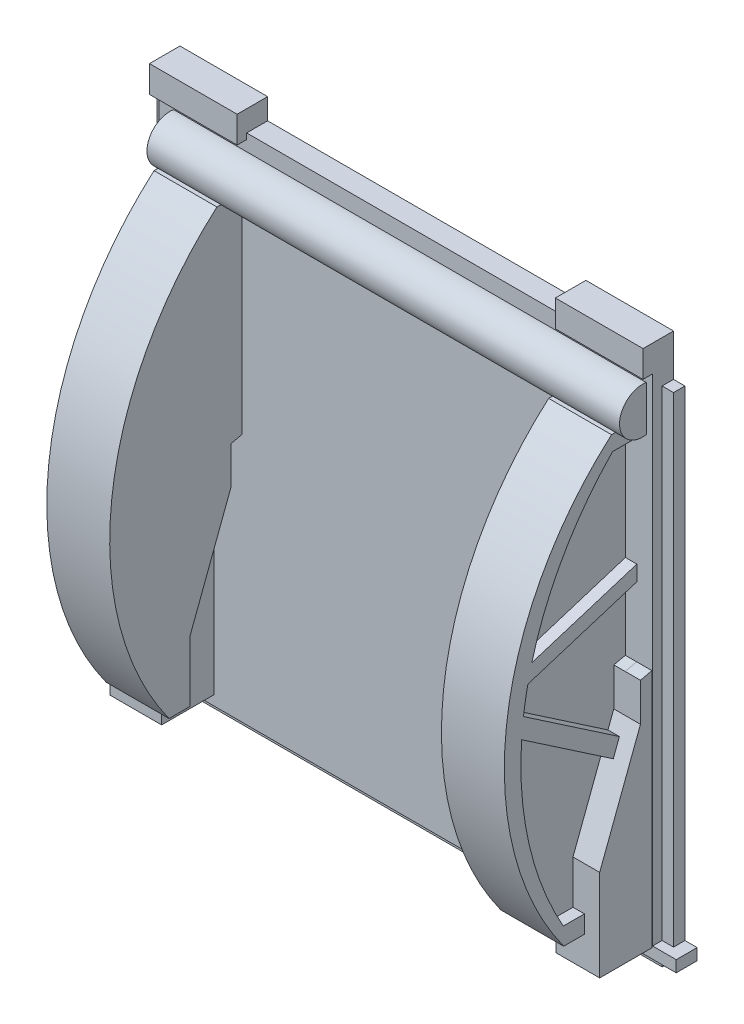
from build123d import *

# Parameters (mm, degrees)
BOSS_EXTRUDE1_DEPTH       = 3
BOSS_EXTRUDE2_DEPTH       = 2.5
SKETCH3_W                 = 23
SKETCH3_H                 = 7
SKETCH3_W_2               = 22.99999237
BOSS_EXTRUDE3_DEPTH       = 2.5
BOSS_EXTRUDE4_DEPTH       = 2.5
BOSS_EXTRUDE4_DEPTH_BACK  = 121.5
BOSS_EXTRUDE5_DEPTH       = 16.5
BOSS_EXTRUDE6_DEPTH       = 4
BOSS_EXTRUDE6_DEPTH_BACK  = 7.5
CUT_EXTRUDE1_DEPTH        = 3
BOSS_EXTRUDE10_DEPTH      = 3
BOSS_EXTRUDE11_DEPTH      = 16.5
CUT_EXTRUDE4_DEPTH        = 3
BOSS_EXTRUDE12_DEPTH      = 3
BOSS_EXTRUDE17_DEPTH      = 9
BOSS_EXTRUDE17_DEPTH_BACK = 4.5


with BuildPart() as part:
    # Sketch1 → Boss-Extrude1 (new body)
    with BuildSketch(Plane.XY):
        Polygon((46.09763001, 79.281773963), (69.09763001, 79.281773963), (69.09763001, 68.281773963), (72.09763001, 68.281773963), (72.09763001, -57.718233666), (75.297626958, -57.718233666), (75.297626958, -60.718233666), (69.09763001, -60.718233666), (69.09763001, -63.718233666), (-60.40236236, -63.718233666), (-60.40236236, -60.718233666), (-66.602374568, -60.718233666), (-66.602374568, -57.718233666), (-63.402377619, -57.718233666), (-63.402377619, 68.281773963), (-60.40236236, 68.281773963), (-60.40236236, 79.281773963), (-37.40236999, 79.281773963), (-37.40236999, 73.781773963), (46.09763001, 73.781773963), align=None)
    extrude(amount=BOSS_EXTRUDE1_DEPTH)

    # Sketch2 → Boss-Extrude2 (add)
    with BuildSketch(Plane.XY.offset(3)):
        Polygon((75.297626958, -57.718233666), (75.297626958, -60.718233666), (-66.602374568, -60.718233666), (-66.602374568, -57.718233666), (-63.402377619, -57.718233666), (-60.40236236, -57.718233666), (-60.40236236, 79.281773963), (-37.40236999, 79.281773963), (-37.40236999, 73.781773963), (46.09763001, 73.781773963), (46.09763001, 79.281773963), (69.09763001, 79.281773963), (69.09763001, -57.718233666), (72.09763001, -57.718233666), align=None)
    extrude(amount=BOSS_EXTRUDE2_DEPTH)

    # Sketch3 → Boss-Extrude3 (add)
    with BuildSketch(Plane.XY.offset(5.5)):
        with Locations((57.59763001, 75.781773963)):
            Rectangle(SKETCH3_W, SKETCH3_H)
        with Locations((-48.902366175, 75.781773963)):
            Rectangle(SKETCH3_W_2, SKETCH3_H)
    extrude(amount=BOSS_EXTRUDE3_DEPTH)


with BuildPart() as body_2:
    # Sketch4 → Boss-Extrude4 (new, two sides: drawn at the far end of the back side and taken through both)
    with BuildSketch(Plane(origin=(65, 0, 0), x_dir=(0, 0, -1), z_dir=(1, 0, 0)).offset(-BOSS_EXTRUDE4_DEPTH_BACK)):
        with BuildLine():
            Line((-5.55975162, 69.556904012), (-5.55975162, 57.724727804))
            ThreePointArc((-5.55975162, 57.724727804), (-12.559753375, 63.640815908), (-5.55975162, 69.556904012))
        make_face()
    extrude(amount=BOSS_EXTRUDE4_DEPTH + BOSS_EXTRUDE4_DEPTH_BACK)

    # Sketch12 → Boss-Extrude11 (add)
    with BuildSketch(Plane(origin=(-55, 0, 0), x_dir=(0, 0, -1), z_dir=(1, 0, 0))):
        with BuildLine():
            Line((-24.765002539, -50.19637914), (-19.265002539, -50.19637914))
            Line((-19.265002539, -50.19637914), (-19.265002539, -34.19637914))
            Line((-19.265002539, -34.19637914), (-8.565818121, -5.896376088))
            Line((-8.565818121, -5.896376088), (-8.565818121, 4.103623912))
            Line((-8.565818121, 4.103623912), (-5.565818121, 4.80362086))
            Line((-5.565818121, 4.80362086), (-5.565818121, 46.80362086))
            Line((-5.565818121, 46.80362086), (-5.598976751, 59.759500072))
            Line((-5.598976751, 59.759500072), (-12.206877997, 59.759500072))
            ThreePointArc((-12.206877997, 59.759500072), (-39.803039234, 7.216198665), (-24.765002539, -50.19637914))
        make_face()
    extrude(amount=BOSS_EXTRUDE11_DEPTH)


with BuildPart() as body_3:
    # Sketch5 → Boss-Extrude5 (new body)
    with BuildSketch(Plane(origin=(65, 0, 0), x_dir=(0, 0, -1), z_dir=(1, 0, 0))):
        with BuildLine():
            Line((-24.725777407, -50.204585987), (-19.225777407, -50.204585987))
            Line((-19.225777407, -50.204585987), (-19.225777407, -34.204585987))
            Line((-19.225777407, -34.204585987), (-8.52659299, -5.904582936))
            Line((-8.52659299, -5.904582936), (-8.52659299, 4.095417064))
            Line((-8.52659299, 4.095417064), (-5.52659299, 4.795414013))
            Line((-5.52659299, 4.795414013), (-5.52659299, 46.795414013))
            Line((-5.52659299, 46.795414013), (-5.55975162, 59.751293224))
            Line((-5.55975162, 59.751293224), (-12.167652865, 59.751293224))
            ThreePointArc((-12.167652865, 59.751293224), (-39.763814103, 7.207991817), (-24.725777407, -50.204585987))
        make_face()
    extrude(amount=-BOSS_EXTRUDE5_DEPTH)

    # Sketch6 → Boss-Extrude6 (add, two sides: drawn at the far end of the back side and taken through both)
    with BuildSketch(Plane(origin=(65, 0, 0), x_dir=(0, 0, -1), z_dir=(1, 0, 0)).offset(-BOSS_EXTRUDE6_DEPTH_BACK)):
        Polygon((-5.580605263, 4.856273773), (-8.580605263, 4.156276825), (-8.580605263, -5.843723175), (-19.27978968, -34.143726227), (-19.27978968, -58.143726227), (-5.580605263, -58.143726227), align=None)
    extrude(amount=BOSS_EXTRUDE6_DEPTH + BOSS_EXTRUDE6_DEPTH_BACK)

    # Sketch8 → Cut-Extrude1 (cut)
    with BuildSketch(Plane(origin=(65, 0, 0), x_dir=(0, 0, -1), z_dir=(1, 0, 0))):
        with BuildLine():
            Line((-19.27978968, -45.567441986), (-24.825883829, -45.567441986))
            ThreePointArc((-24.825883829, -45.567441986), (-35.272775247, 7.256179371), (-11.908850044, 55.770089878))
            Line((-11.908850044, 55.770089878), (-5.5, 55.770089878))
            Line((-5.5, 55.770089878), (-5.52659299, 4.795414013))
            Line((-5.52659299, 4.795414013), (-8.580605263, 4.156276825))
            Line((-8.580605263, 4.156276825), (-8.580605263, -5.843723175))
            Line((-8.580605263, -5.843723175), (-19.27978968, -34.143726227))
            Line((-19.27978968, -34.143726227), (-19.27978968, -45.567441986))
        make_face()
    extrude(amount=-CUT_EXTRUDE1_DEPTH, mode=Mode.SUBTRACT)

    # Sketch10 → Boss-Extrude10 (add)
    with BuildSketch(Plane(origin=(62, 0, 0), x_dir=(0, 0, -1), z_dir=(1, 0, 0))):
        with BuildLine():
            Line((-35.272775247, 7.256179371), (-10.101614538, -9.866886572))
            Line((-10.101614538, -9.866886572), (-11.709528889, -14.119919258))
            Line((-11.709528889, -14.119919258), (-35.761533968, 2.241824))
            ThreePointArc((-35.761533968, 2.241824), (-35.554284628, 4.752620819), (-35.272775247, 7.256179371))
        make_face()
        with BuildLine():
            Line((-34.126934324, 14.043259917), (-5.5, 23.014061585))
            Line((-5.5, 23.014061585), (-5.52659299, 27.031368564))
            Line((-5.52659299, 27.031368564), (-33.089848914, 18.393891026))
            ThreePointArc((-33.089848914, 18.393891026), (-33.636989057, 16.22539241), (-34.126934324, 14.043259917))
        make_face()
    extrude(amount=BOSS_EXTRUDE10_DEPTH)


with BuildPart() as cut_extrude4_tool:
    # Sketch14 → Cut-Extrude4 (new body)
    with BuildSketch(Plane(origin=(-55, 0, 0), x_dir=(0, 0, -1), z_dir=(1, 0, 0))):
        with BuildLine():
            Line((-19.266491083, -45.667389439), (-24.812585231, -45.667389439))
            ThreePointArc((-24.812585231, -45.667389439), (-35.259476649, 7.156231918), (-11.895551446, 55.670142425))
            Line((-11.895551446, 55.670142425), (-5.486701402, 55.670142425))
            Line((-5.486701402, 55.670142425), (-5.513294392, 4.69546656))
            Line((-5.513294392, 4.69546656), (-8.567306665, 4.056329372))
            Line((-8.567306665, 4.056329372), (-8.567306665, -5.943670628))
            Line((-8.567306665, -5.943670628), (-19.266491083, -34.24367368))
            Line((-19.266491083, -34.24367368), (-19.266491083, -45.667389439))
        make_face()
    extrude(amount=CUT_EXTRUDE4_DEPTH)


with BuildPart() as part_1:
    add(part.part)

    # Cut-Extrude4: cut by cut_extrude4_tool
    add(cut_extrude4_tool.part, mode=Mode.SUBTRACT)



with BuildPart() as body_2_1:
    add(body_2.part)

    # Cut-Extrude4: cut by cut_extrude4_tool
    add(cut_extrude4_tool.part, mode=Mode.SUBTRACT)


with BuildPart() as part_2:
    add(part_1.part)

    add(body_2_1.part)  # Boss-Extrude12 merges body 2
    # Sketch15 → Boss-Extrude12 (add)
    with BuildSketch(Plane(origin=(-55, 0, 0), x_dir=(0, 0, -1), z_dir=(1, 0, 0))):
        with BuildLine():
            Line((-35.133735113, 7.713458412), (-9.962574404, -9.409607532))
            Line((-9.962574404, -9.409607532), (-11.570488755, -13.662640217))
            Line((-11.570488755, -13.662640217), (-35.622493834, 2.699103041))
            ThreePointArc((-35.622493834, 2.699103041), (-35.415244494, 5.20989986), (-35.133735113, 7.713458412))
        make_face()
        with BuildLine():
            Line((-33.98789419, 14.500538957), (-5.360959866, 23.471340625))
            Line((-5.360959866, 23.471340625), (-5.387552856, 27.488647605))
            Line((-5.387552856, 27.488647605), (-32.95080878, 18.851170066))
            ThreePointArc((-32.95080878, 18.851170066), (-33.497948923, 16.68267145), (-33.98789419, 14.500538957))
        make_face()
    extrude(amount=BOSS_EXTRUDE12_DEPTH)


with BuildPart() as body_3_2:
    # Sketch19 → Boss-Extrude17 (new, two sides: drawn at the far end of the back side and taken through both)
    with BuildSketch(Plane(origin=(-55, 0, 0), x_dir=(0, 0, -1), z_dir=(1, 0, 0)).offset(-BOSS_EXTRUDE17_DEPTH_BACK)):
        Polygon((-5.510163177, 4.814134961), (-8.510163177, 4.114138013), (-8.510163177, -5.885861987), (-19.209347595, -34.185865039), (-19.209347595, -58.185865039), (-5.510163177, -58.185865039), align=None)
    extrude(amount=BOSS_EXTRUDE17_DEPTH + BOSS_EXTRUDE17_DEPTH_BACK)


solid = Compound([body_3.part, part_2.part, body_3_2.part])
